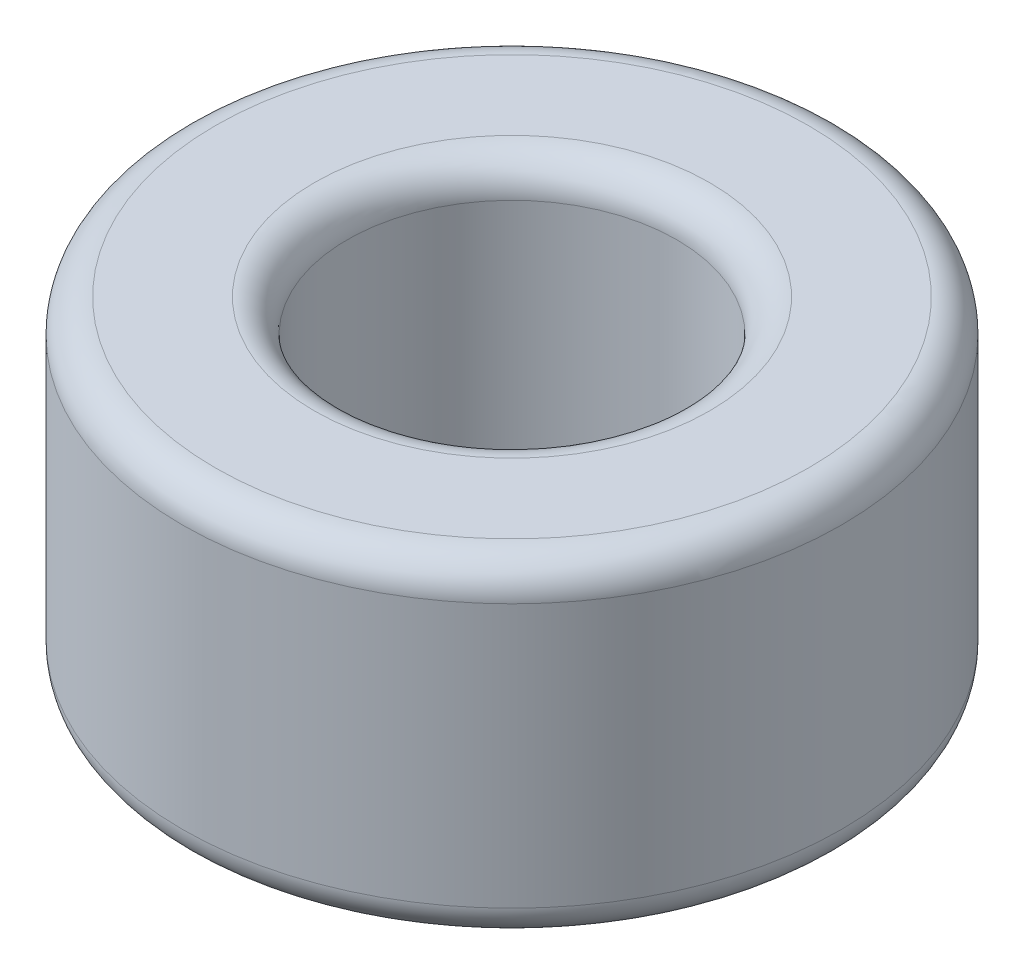
from build123d import *


with BuildPart() as part:
    # Esboço1 → Revolução1 (revolve)
    with BuildSketch(Plane(origin=(0, 0, 0), x_dir=(0, 0, -1), z_dir=(1, 0, 0))):
        with BuildLine():
            Line((-4.5, 2.5), (-3, 2.5))
            ThreePointArc((-3, 2.5), (-2.646446609, 2.353553391), (-2.5, 2))
            Line((-2.5, 2), (-2.5, -2))
            ThreePointArc((-2.5, -2), (-2.646446609, -2.353553391), (-3, -2.5))
            Line((-3, -2.5), (-4.5, -2.5))
            ThreePointArc((-4.5, -2.5), (-4.853553391, -2.353553391), (-5, -2))
            Line((-5, -2), (-5, 2))
            ThreePointArc((-5, 2), (-4.853553391, 2.353553391), (-4.5, 2.5))
        make_face()
    revolve(axis=Axis((0, 0, 0), (0, -1, 0)))


solid = part.part
